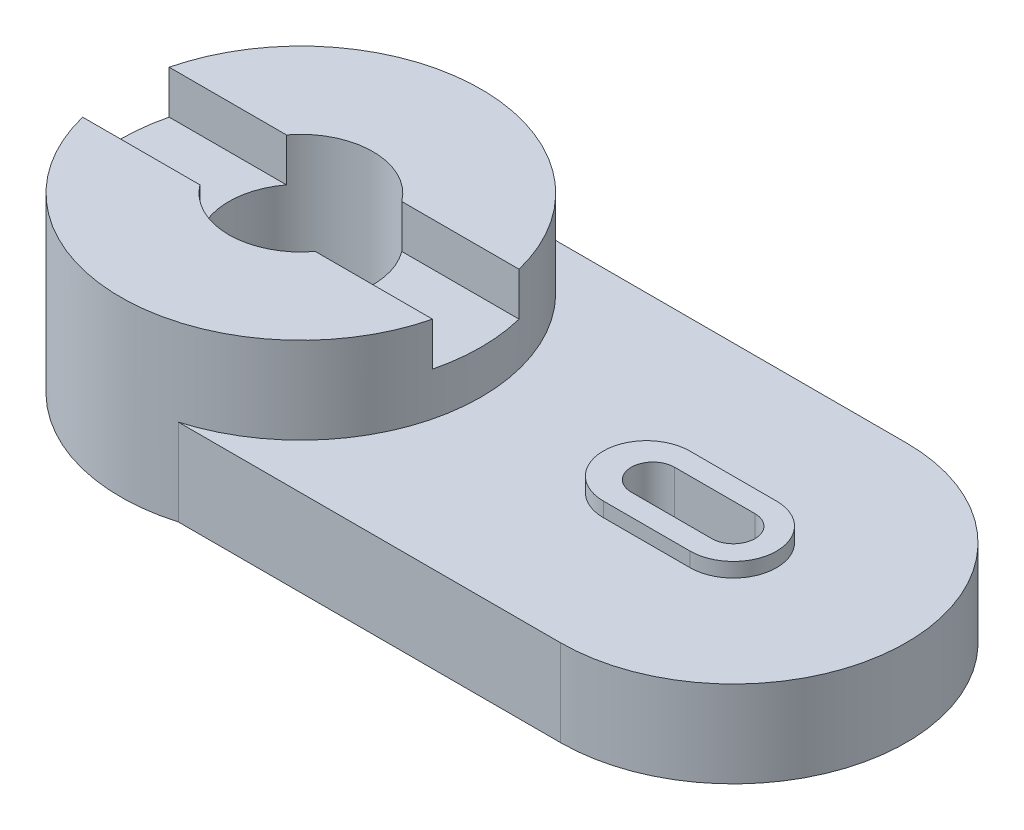
from build123d import *

# Parameters (mm, degrees)
SKETCH2_W           = 152.4
SKETCH2_H           = 121.92
BOSS_EXTRUDE1_DEPTH = 30.48
SKETCH3_R           = 63.5
BOSS_EXTRUDE2_DEPTH = 30.48
SKETCH4_R           = 25.4
CUT_EXTRUDE1_DEPTH  = 60.96
BOSS_EXTRUDE3_DEPTH = 30.48
BOSS_EXTRUDE5_DEPTH = 5.08
CUT_EXTRUDE4_DEPTH  = 35.56
CUT_EXTRUDE5_DEPTH  = 15.24


with BuildPart() as part:
    # Sketch2 → Boss-Extrude1 (new body)
    with BuildSketch(Plane(origin=(0, 0, 0), x_dir=(1, 0, 0), z_dir=(0, 1, 0))):
        Rectangle(SKETCH2_W, SKETCH2_H)
    extrude(amount=BOSS_EXTRUDE1_DEPTH)

    # Sketch3 → Boss-Extrude2 (add, symmetric)
    with BuildSketch(Plane(origin=(0, 30.48, 0), x_dir=(1, 0, 0), z_dir=(0, 1, 0))):
        with Locations(Location((-76.2, 0, 0), (0, 0, 73.739795292))):
            Circle(SKETCH3_R)
    extrude(amount=BOSS_EXTRUDE2_DEPTH, both=True)

    # Sketch4 → Cut-Extrude1 (cut)
    with BuildSketch(Plane(origin=(0, 60.96, 0), x_dir=(1, 0, 0), z_dir=(0, 1, 0))):
        with Locations(Location((-76.2, 0, 0), (0, 0, 270))):
            Circle(SKETCH4_R)
    extrude(amount=-CUT_EXTRUDE1_DEPTH, mode=Mode.SUBTRACT)

    # Sketch5 → Boss-Extrude3 (add)
    with BuildSketch(Plane(origin=(0, 30.48, 0), x_dir=(1, 0, 0), z_dir=(0, 1, 0))):
        with BuildLine():
            Line((76.2, 60.96), (76.2, -60.96))
            ThreePointArc((76.2, -60.96), (137.16, 0), (76.2, 60.96))
        make_face()
    extrude(amount=-BOSS_EXTRUDE3_DEPTH)

    # Sketch6 → Boss-Extrude5 (add)
    with BuildSketch(Plane(origin=(0, 30.48, 0), x_dir=(1, 0, 0), z_dir=(0, 1, 0))):
        with BuildLine():
            Line((76.2, -15.24), (45.597337332, -15.24))
            ThreePointArc((45.597337332, -15.24), (30.357337332, 0), (45.597337332, 15.24))
            Line((45.597337332, 15.24), (76.2, 15.24))
            ThreePointArc((76.2, 15.24), (91.44, 0), (76.2, -15.24))
        make_face()
    extrude(amount=BOSS_EXTRUDE5_DEPTH)

    # Sketch12 → Cut-Extrude4 (cut)
    with BuildSketch(Plane(origin=(0, 35.56, 0), x_dir=(1, 0, 0), z_dir=(0, 1, 0))):
        with BuildLine():
            Line((76.2, -7.62), (47.846010547, -7.62))
            ThreePointArc((47.846010547, -7.62), (40.226010547, 0), (47.846010547, 7.62))
            Line((47.846010547, 7.62), (76.2, 7.62))
            ThreePointArc((76.2, 7.62), (83.82, 0), (76.2, -7.62))
        make_face()
    extrude(amount=-CUT_EXTRUDE4_DEPTH, mode=Mode.SUBTRACT)

    # Sketch14 → Cut-Extrude5 (cut)
    with BuildSketch(Plane(origin=(0, 60.96, 0), x_dir=(1, 0, 0), z_dir=(0, 1, 0))):
        with BuildLine():
            Line((-137.844078386, -15.24), (-14.555921614, -15.24))
            ThreePointArc((-14.555921614, -15.24), (-12.7, 0), (-14.555921614, 15.24))
            Line((-14.555921614, 15.24), (-137.844078386, 15.24))
            ThreePointArc((-137.844078386, 15.24), (-139.7, 0), (-137.844078386, -15.24))
        make_face()
    extrude(amount=-CUT_EXTRUDE5_DEPTH, mode=Mode.SUBTRACT)


solid = part.part
